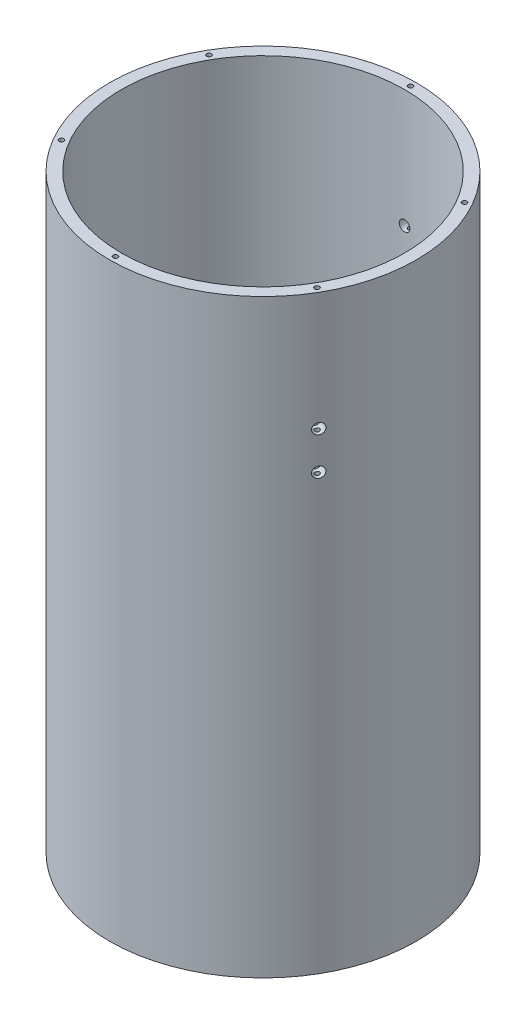
from build123d import *

# Parameters (mm, degrees)
ESQUISSE1_R                    = 65
BOSS_EXTRU_1_DEPTH             = 250
ESQUISSE2_R                    = 60
ENL_V_MAT_EXTRU_1_DEPTH        = 250
ESQUISSE7_R                    = 1
ENL_V_MAT_EXTRU_2_DEPTH        = 267.364412037
D_GAGEMENT_M41_D               = 4.5
D_GAGEMENT_M41_DEPTH           = 20
D_GAGEMENT_M41_TIP             = 1.351936393
D_GAGEMENT_M42_D               = 4.5
D_GAGEMENT_M42_DEPTH           = 20
D_GAGEMENT_M42_TIP             = 1.351936393
D_GAGEMENT_M44_D               = 4.5
D_GAGEMENT_M44_DEPTH           = 20
D_GAGEMENT_M44_TIP             = 1.351936393
D_GAGEMENT_M44_ON_FACE_2_D     = 4.5
D_GAGEMENT_M44_ON_FACE_2_DEPTH = 20
D_GAGEMENT_M44_ON_FACE_2_TIP   = 1.351936393
D_GAGEMENT_M45_D               = 4.5
D_GAGEMENT_M45_DEPTH           = 20
D_GAGEMENT_M45_TIP             = 1.351936393
D_GAGEMENT_M45_ON_FACE_2_D     = 4.5
D_GAGEMENT_M45_ON_FACE_2_DEPTH = 20
D_GAGEMENT_M45_ON_FACE_2_TIP   = 1.351936393


with BuildPart() as part:
    # Esquisse1 → Boss.-Extru.1 (new body)
    with BuildSketch(Plane(origin=(0, 0, 0), x_dir=(1, 0, 0), z_dir=(0, 1, 0))):
        with Locations(Location((0, 0, 0), (0, 0, 270))):
            Circle(ESQUISSE1_R)
    extrude(amount=BOSS_EXTRU_1_DEPTH)

    # Esquisse2 → Enlèv. mat.-Extru.1 (cut)
    with BuildSketch(Plane(origin=(0, 250, 0), x_dir=(1, 0, 0), z_dir=(0, 1, 0))):
        with Locations(Location((0, 0, 0), (0, 0, 270))):
            Circle(ESQUISSE2_R)
    extrude(amount=-ENL_V_MAT_EXTRU_1_DEPTH, mode=Mode.SUBTRACT)

    # Esquisse7 → Enlèv. mat.-Extru.2 (cut, through all)
    with BuildSketch(Plane(origin=(0, 250, 0), x_dir=(1, 0, 0), z_dir=(0, 1, 0))):
        with Locations(Location((-54.126587737, 31.25, 0), (0, 0, 270))):
            Circle(ESQUISSE7_R)
        with Locations(Location((-54.126587737, -31.25, 0), (0, 0, 270))):
            Circle(ESQUISSE7_R)
        with Locations(Location((0, -62.5, 0), (0, 0, 270))):
            Circle(ESQUISSE7_R)
        with Locations(Location((54.126587737, -31.25, 0), (0, 0, 270))):
            Circle(ESQUISSE7_R)
        with Locations(Location((54.126587737, 31.25, 0), (0, 0, 270))):
            Circle(ESQUISSE7_R)
        with Locations(Location((0, 62.5, 0), (0, 0, 270))):
            Circle(ESQUISSE7_R)
    extrude(amount=-ENL_V_MAT_EXTRU_2_DEPTH, mode=Mode.SUBTRACT)

    # Dégagement M41
    with Locations(Plane(origin=(0, 200, -65), x_dir=(-1, 0, 0), z_dir=(0, 0, -1))):
        with Locations((0, 0)):
            Hole(D_GAGEMENT_M41_D / 2, depth=D_GAGEMENT_M41_DEPTH)
            with Locations((0, 0, -(D_GAGEMENT_M41_DEPTH + D_GAGEMENT_M41_TIP / 2))):  # 118° drill point
                Cone(0, D_GAGEMENT_M41_D / 2, D_GAGEMENT_M41_TIP, mode=Mode.SUBTRACT)

    # Dégagement M42
    with Locations(Plane(origin=(0, 184, -65), x_dir=(-1, 0, 0), z_dir=(0, 0, -1))):
        with Locations((0, 0)):
            Hole(D_GAGEMENT_M42_D / 2, depth=D_GAGEMENT_M42_DEPTH)
            with Locations((0, 0, -(D_GAGEMENT_M42_DEPTH + D_GAGEMENT_M42_TIP / 2))):  # 118° drill point
                Cone(0, D_GAGEMENT_M42_D / 2, D_GAGEMENT_M42_TIP, mode=Mode.SUBTRACT)

    # Dégagement M44
    with Locations(Plane(origin=(56.233797667, 200, 32.6), x_dir=(-0.501538461538, 0, 0.865135348716), z_dir=(0.865135348716, 0, 0.501538461538))):
        with Locations((0, 0)):
            Hole(D_GAGEMENT_M44_D / 2, depth=D_GAGEMENT_M44_DEPTH)
            with Locations((0, 0, -(D_GAGEMENT_M44_DEPTH + D_GAGEMENT_M44_TIP / 2))):  # 118° drill point
                Cone(0, D_GAGEMENT_M44_D / 2, D_GAGEMENT_M44_TIP, mode=Mode.SUBTRACT)

    # Dégagement M44 on face 2
    with Locations(Plane(origin=(56.233797667, 184, 32.6), x_dir=(-0.501538267403, 0, 0.865135461261), z_dir=(0.865135461261, 0, 0.501538267403))):
        with Locations((0, 0)):
            Hole(D_GAGEMENT_M44_ON_FACE_2_D / 2, depth=D_GAGEMENT_M44_ON_FACE_2_DEPTH)
            with Locations((0, 0, -(D_GAGEMENT_M44_ON_FACE_2_DEPTH + D_GAGEMENT_M44_ON_FACE_2_TIP / 2))):  # 118° drill point
                Cone(0, D_GAGEMENT_M44_ON_FACE_2_D / 2, D_GAGEMENT_M44_ON_FACE_2_TIP, mode=Mode.SUBTRACT)

    # Dégagement M45
    with Locations(Plane(origin=(-56.233797667, 200, 32.6), x_dir=(-0.501538461538, 0, -0.865135348716), z_dir=(-0.865135348716, 0, 0.501538461538))):
        with Locations((0, 0)):
            Hole(D_GAGEMENT_M45_D / 2, depth=D_GAGEMENT_M45_DEPTH)
            with Locations((0, 0, -(D_GAGEMENT_M45_DEPTH + D_GAGEMENT_M45_TIP / 2))):  # 118° drill point
                Cone(0, D_GAGEMENT_M45_D / 2, D_GAGEMENT_M45_TIP, mode=Mode.SUBTRACT)

    # Dégagement M45 on face 2
    with Locations(Plane(origin=(-56.233797667, 184, 32.6), x_dir=(-0.501538267403, 0, -0.865135461261), z_dir=(-0.865135461261, 0, 0.501538267403))):
        with Locations((0, 0)):
            Hole(D_GAGEMENT_M45_ON_FACE_2_D / 2, depth=D_GAGEMENT_M45_ON_FACE_2_DEPTH)
            with Locations((0, 0, -(D_GAGEMENT_M45_ON_FACE_2_DEPTH + D_GAGEMENT_M45_ON_FACE_2_TIP / 2))):  # 118° drill point
                Cone(0, D_GAGEMENT_M45_ON_FACE_2_D / 2, D_GAGEMENT_M45_ON_FACE_2_TIP, mode=Mode.SUBTRACT)


solid = part.part
